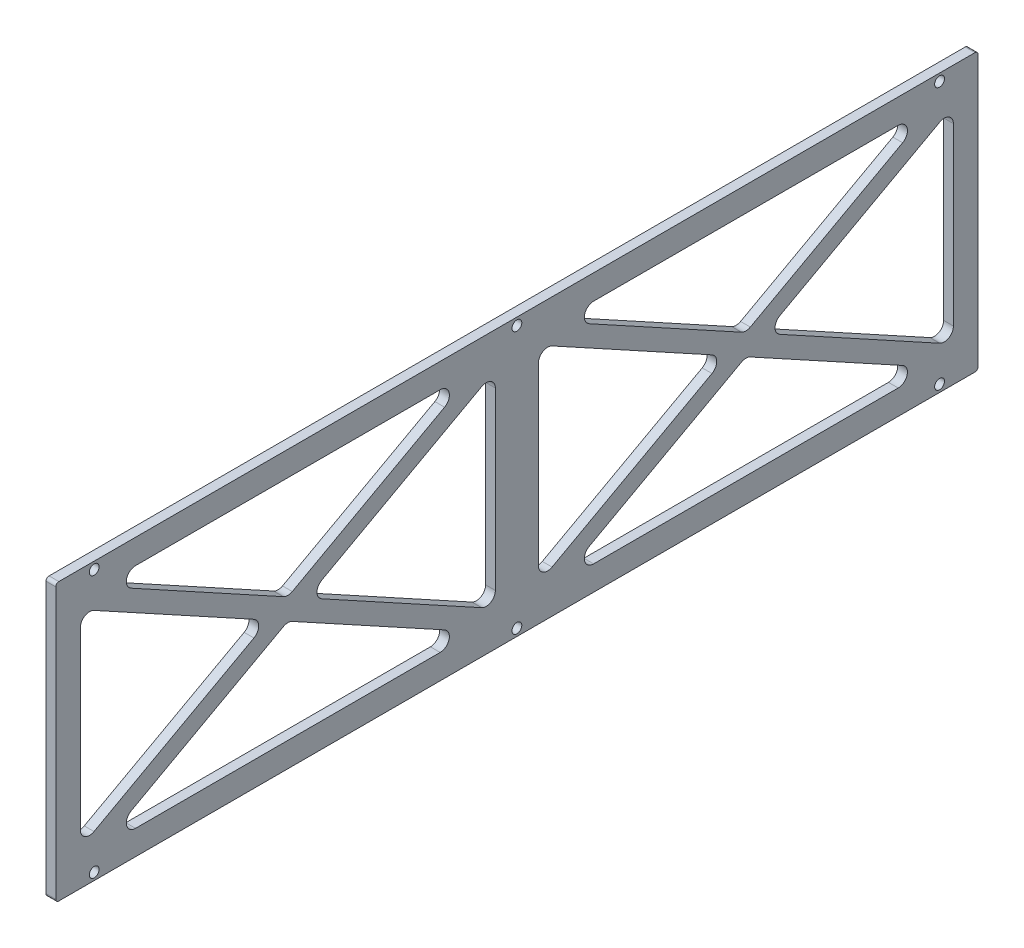
from build123d import *

# Parameters (mm, degrees)
SKETCH2_W            = 300
SKETCH2_H            = 90
BOSS_EXTRUDE1_DEPTH  = 3.175
CUT_EXTRUDE2_DEPTH   = 157.636779286
M3_CLEARANCE_HOLE1_D = 3.2
FILLET1_R            = 3
FILLET2_R            = 1


with BuildPart() as part:
    # Sketch2 → Boss-Extrude1 (new body)
    with BuildSketch(Plane(origin=(0, 0, 0), x_dir=(0, 0, -1), z_dir=(1, 0, 0))):
        Rectangle(SKETCH2_W, SKETCH2_H)
    extrude(amount=BOSS_EXTRUDE1_DEPTH)

    # Sketch4 → Cut-Extrude2 (cut, through all)
    with BuildSketch(Plane(origin=(3.175, 0, 0), x_dir=(0, 0, -1), z_dir=(1, 0, 0))):
        Polygon((-135.758731446, 37), (-13.241268554, 37), (-74.5, 3.4211398), align=None)
        Polygon((-7, 33.5788602), (-7, -33.5788602), (-68.258731446, 0), align=None)
        Polygon((-13.241268554, -37), (-135.758731446, -37), (-74.5, -3.4211398), align=None)
        Polygon((-142, -33.5788602), (-142, 33.5788602), (-80.741268554, 0), align=None)
        Polygon((135.758731446, 37), (13.241268554, 37), (74.5, 3.4211398), align=None)
        Polygon((142, 33.5788602), (80.741268554, 0), (142, -33.5788602), align=None)
        Polygon((135.758731446, -37), (74.5, -3.4211398), (13.241268554, -37), align=None)
        Polygon((7, -33.5788602), (68.258731446, 0), (7, 33.5788602), align=None)
    extrude(amount=-CUT_EXTRUDE2_DEPTH, mode=Mode.SUBTRACT)

    # M3 Clearance Hole1 (through all)
    with Locations(Plane(origin=(3.175, 0, 0), x_dir=(0, 0, -1), z_dir=(1, 0, 0))):
        with Locations((-137.5, 42.61875), (137.5, 42.61875), (137.5, -42.61875), (-137.5, -42.61875), (0, 42.61875), (0, -42.61875)):
            Hole(M3_CLEARANCE_HOLE1_D / 2)

    # Fillet1
    fillet1_edges = [part.edges().sort_by_distance(p)[0] for p in [
        (1.5875, 37, -135.758731446),
        (1.5875, 3.4211398, -74.5),
        (1.5875, 37, -13.241268554),
        (1.5875, 0, 80.741268554),
        (1.5875, -33.5788602, 142),
        (1.5875, 33.5788602, 142),
        (1.5875, 0, 68.258731446),
        (1.5875, 33.5788602, 7),
        (1.5875, -33.5788602, 7),
        (1.5875, -3.4211398, 74.5),
        (1.5875, -37, 13.241268554),
        (1.5875, -37, 135.758731446),
        (1.5875, -33.5788602, -7),
        (1.5875, 33.5788602, -7),
        (1.5875, 0, -68.258731446),
        (1.5875, 33.5788602, -142),
        (1.5875, -33.5788602, -142),
        (1.5875, 0, -80.741268554),
        (1.5875, -37, -135.758731446),
        (1.5875, -37, -13.241268554),
        (1.5875, -3.4211398, -74.5),
        (1.5875, 3.4211398, 74.5),
        (1.5875, 37, 135.758731446),
        (1.5875, 37, 13.241268554),
    ]]
    fillet(fillet1_edges, radius=FILLET1_R)

    # Fillet2
    fillet2_edges = [part.edges().sort_by_distance(p)[0] for p in [
        (1.5875, -45, -150),
        (1.5875, -45, 150),
        (1.5875, 45, 150),
        (1.5875, 45, -150),
    ]]
    fillet(fillet2_edges, radius=FILLET2_R)


solid = part.part
